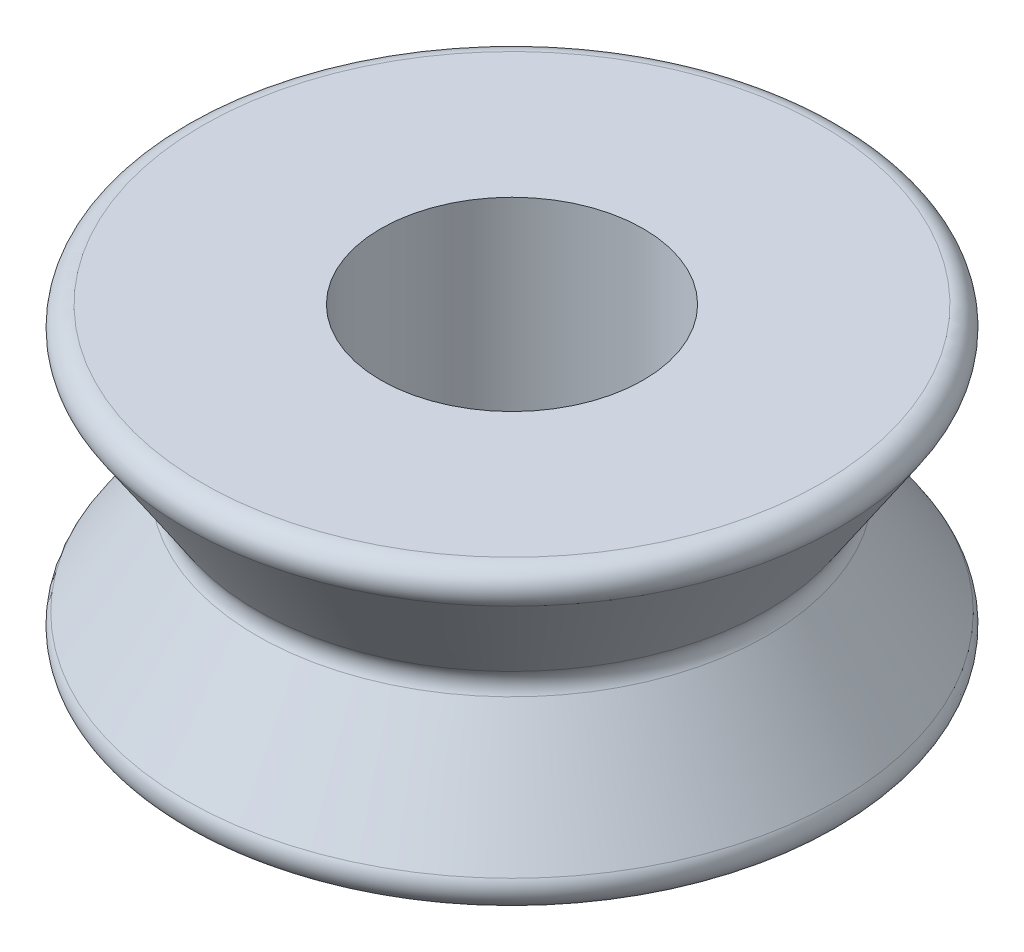
from build123d import *

# Parameters (mm, degrees)
CONG_1_R         = 0.4
D_GAGEMENT_M51_D = 5.3


with BuildPart() as part:
    # Esquisse2 → Révolution1 (revolve)
    with BuildSketch(Plane.XY):
        Polygon((-7, 3), (-5, 0), (-7, -3), (0, -3), (0, 3), align=None)
    revolve(axis=Axis((0, 3, 0), (0, -1, 0)))

    # Congé1
    cong_1_edges = [part.edges().sort_by_distance(p)[0] for p in [
        (7, 3, 0),
        (5, 0, 0),
        (7, -3, 0),
    ]]
    fillet(cong_1_edges, radius=CONG_1_R)

    # Dégagement M51 (through all)
    with Locations(Plane(origin=(0, 3, 0), x_dir=(1, 0, 0), z_dir=(0, 1, 0))):
        with Locations((0, 0)):
            Hole(D_GAGEMENT_M51_D / 2)


solid = part.part
